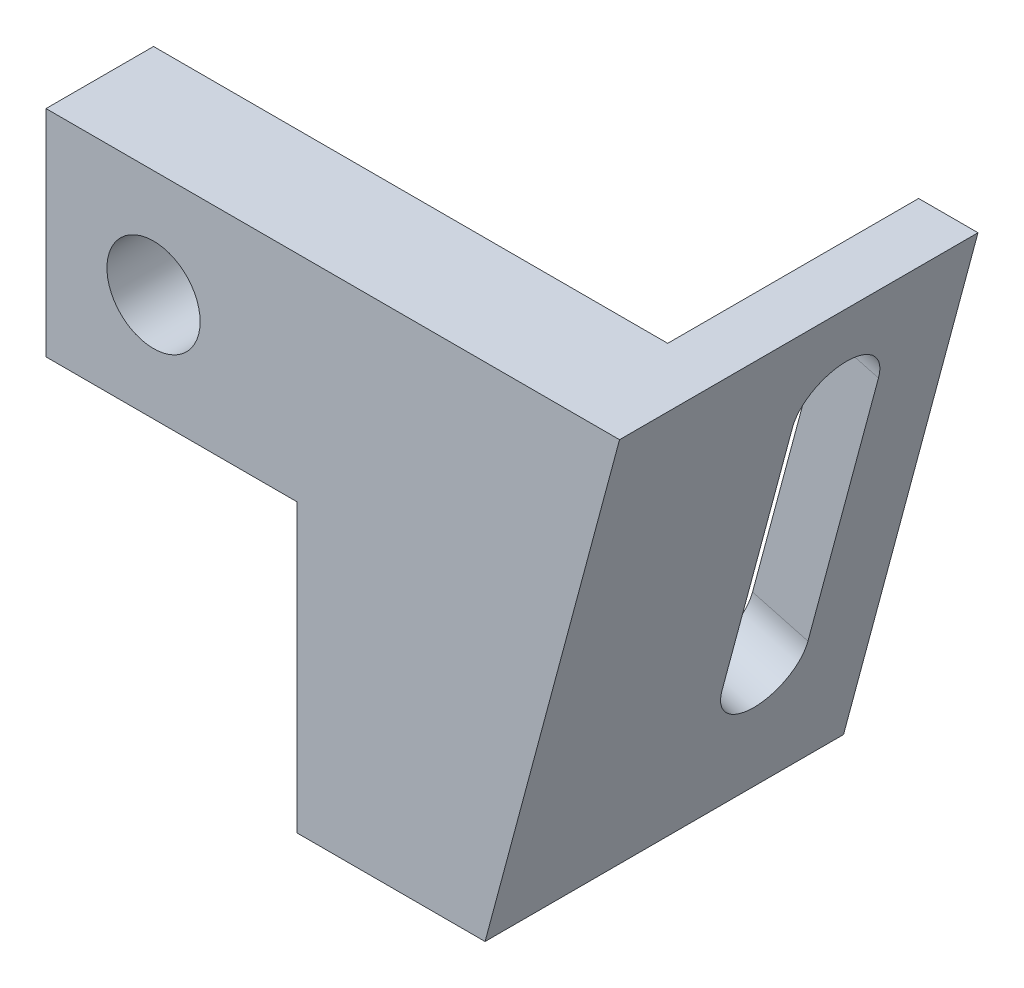
from build123d import *

# Parameters (mm, degrees)
ESBO_O1_R                = 6.5
RESSALTO_EXTRUS_O1_DEPTH = 15
RESSALTO_EXTRUS_O2_DEPTH = 35
CORTE_EXTRUS_O1_REACH    = 88.344


with BuildPart() as part:
    # Esboço1 → Ressalto-extrusão1 (new body)
    with BuildSketch(Plane.XY):
        Polygon((-31.616849906, 46.570948478), (-50.373293376, -23.429051522), (-76.616849906, -23.429051522), (-76.616849906, 16.570948478), (-111.616849906, 16.570948478), (-111.616849906, 46.570948478), align=None)
        with Locations((-96.616849906, 31.570948478)):
            Circle(ESBO_O1_R, mode=Mode.SUBTRACT)
    extrude(amount=RESSALTO_EXTRUS_O1_DEPTH)

    # Esboço2 → Ressalto-extrusão2 (add)
    with BuildSketch(Plane(origin=(0, 0, 0), x_dir=(-1, 0, 0), z_dir=(0, 0, -1))):
        Polygon((58.655502819, -23.429051522), (39.899059349, 46.570948478), (31.616849906, 46.570948478), (50.373293376, -23.429051522), align=None)
    extrude(amount=RESSALTO_EXTRUS_O2_DEPTH)

    # Esboço3 → Corte-extrusão1 (cut, up to next)
    with BuildSketch(Plane(origin=(-41.141659675, 11.023874485, 0), x_dir=(0, 0, -1), z_dir=(0.9659258262890673, -0.25881904510252474, 0)), mode=Mode.PRIVATE) as corte_extrus_o1_sk1:
        with BuildLine():
            Line((13, 21.801038988), (13, -16.198961012))
            ThreePointArc((13, -16.198961012), (19, -22.198961012), (25, -16.198961012))
            Line((25, -16.198961012), (25, 21.801038988))
            ThreePointArc((25, 21.801038988), (19, 27.801038988), (13, 21.801038988))
        make_face()
    corte_extrus_o1_tool1 = extrude(corte_extrus_o1_sk1.sketch, amount=-CORTE_EXTRUS_O1_REACH, mode=Mode.PRIVATE) & part.part
    add(corte_extrus_o1_tool1.solids().sort_by_distance((-40.416697, 13.72947, -19))[0], mode=Mode.SUBTRACT)


solid = part.part
